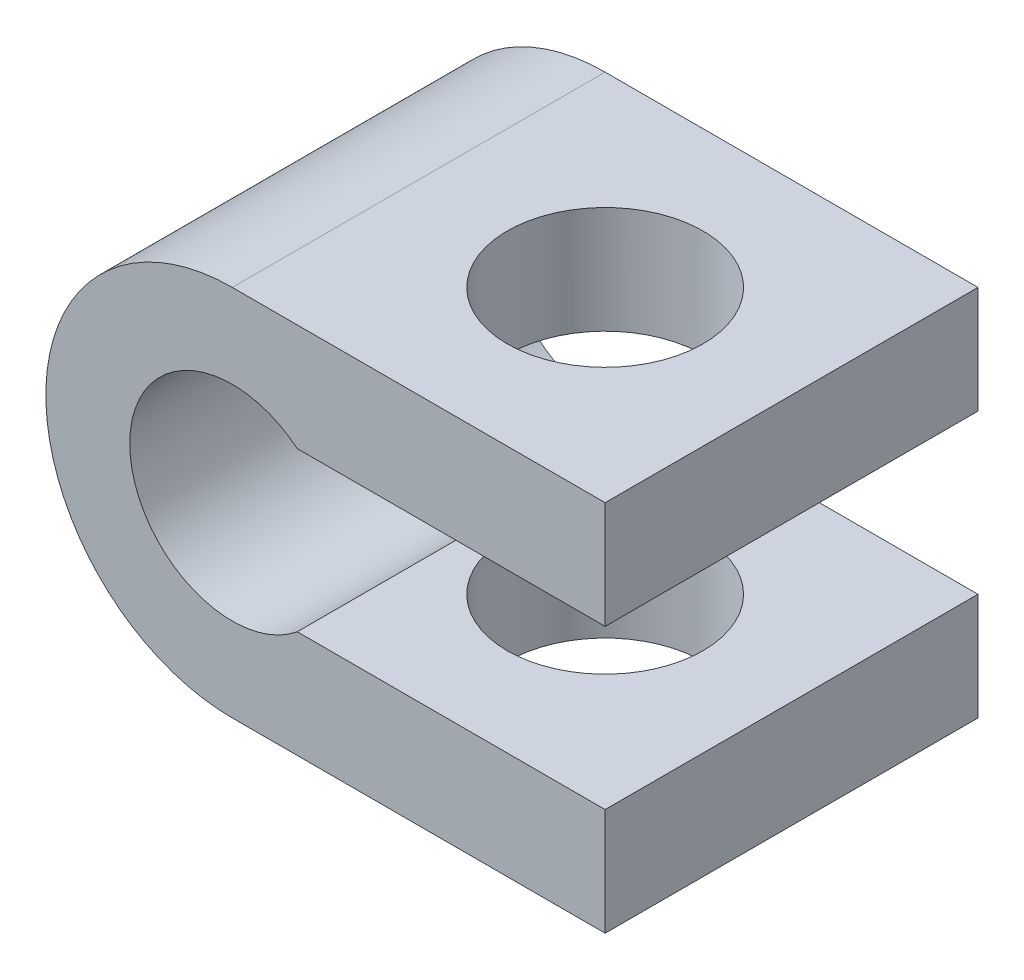
from build123d import *

# Parameters (mm, degrees)
BOSS_EXTRUDE1_DEPTH     = 12
CUT_EXTRUDE1_DEPTH      = 19
CUT_EXTRUDE1_DEPTH_BACK = 19
SKETCH2_R               = 3.15


with BuildPart() as part:
    # Sketch1 → Boss-Extrude1 (new body)
    with BuildSketch(Plane.XY):
        with BuildLine():
            Line((0, 6), (12, 6))
            Line((12, 6), (12, 2.552710574))
            Line((12, 2.552710574), (2.091331807, 2.552710574))
            ThreePointArc((2.091331807, 2.552710574), (-3.3, 0), (2.091331807, -2.552710574))
            Line((2.091331807, -2.552710574), (12, -2.552710574))
            Line((12, -2.552710574), (12, -6))
            Line((12, -6), (0, -6))
            ThreePointArc((0, -6), (-6, 0), (0, 6))
        make_face()
    extrude(amount=BOSS_EXTRUDE1_DEPTH)

    # Sketch2 → Cut-Extrude1 (cut, two sides: drawn at the far end of the back side and taken through both)
    with BuildSketch(Plane(origin=(0, 0, 0), x_dir=(1, 0, 0), z_dir=(0, 1, 0)).offset(-CUT_EXTRUDE1_DEPTH_BACK)):
        with Locations(Location((6, -6, 0), (0, 0, 270))):
            Circle(SKETCH2_R)
    extrude(amount=CUT_EXTRUDE1_DEPTH + CUT_EXTRUDE1_DEPTH_BACK, mode=Mode.SUBTRACT)


solid = part.part
